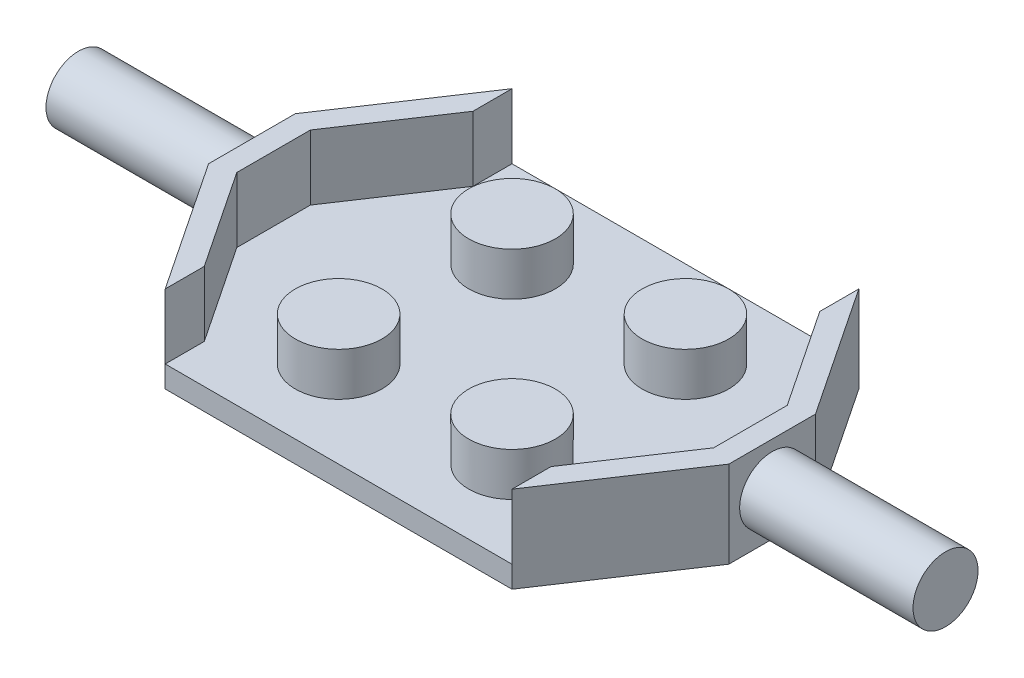
from build123d import *

# Parameters (mm, degrees)
BOSS_EXTRUDE1_DEPTH = 1
SKETCH2_R           = 2
BOSS_EXTRUDE2_DEPTH = 2
BOSS_EXTRUDE3_DEPTH = 3
SKETCH4_R           = 1.5
BOSS_EXTRUDE4_DEPTH = 8


with BuildPart() as part:
    # Sketch1 → Boss-Extrude1 (new body)
    with BuildSketch(Plane(origin=(0, 0, 0), x_dir=(1, 0, 0), z_dir=(0, 1, 0))):
        Polygon((0, -8), (0, 0), (-12, 0), (-12, -2), (-8, -8), align=None)
        Polygon((-12, 0), (0, 0), (0, 8), (-8, 8), (-12, 2), align=None)
    boss_extrude1 = extrude(amount=BOSS_EXTRUDE1_DEPTH)

    # Sketch2 → Boss-Extrude2 (add)
    with BuildSketch(Plane(origin=(0, 1, 0), x_dir=(1, 0, 0), z_dir=(0, 1, 0))):
        with Locations(Location((-4, 4, 0), (0, 0, 270))):
            Circle(SKETCH2_R)
        with Locations(Location((-4, -4, 0), (0, 0, 90))):
            Circle(SKETCH2_R)
    boss_extrude2 = extrude(amount=BOSS_EXTRUDE2_DEPTH)

    # Sketch3 → Boss-Extrude3 (add)
    with BuildSketch(Plane(origin=(0, 1, 0), x_dir=(1, 0, 0), z_dir=(0, 1, 0))):
        Polygon((-12, -2), (-8, -8), (-8, -6.197224362), (-11, -1.697224362), (-11, 1.697224362), (-8, 6.197224362), (-8, 8), (-12, 2), align=None)
    boss_extrude3 = extrude(amount=BOSS_EXTRUDE3_DEPTH)

    # Sketch4 → Boss-Extrude4 (add)
    with BuildSketch(Plane.ZY.offset(12)):
        with Locations((0, 2)):
            Circle(SKETCH4_R)
    boss_extrude4 = extrude(amount=BOSS_EXTRUDE4_DEPTH)

    # Mirror1: Boss-Extrude1, Boss-Extrude2, Boss-Extrude3, Boss-Extrude4 across plane
    add(boss_extrude1.mirror(Plane(origin=(0, 0, 0), x_dir=(0, 0, 1), z_dir=(1, 0, 0))))
    add(boss_extrude2.mirror(Plane(origin=(0, 0, 0), x_dir=(0, 0, 1), z_dir=(1, 0, 0))))
    add(boss_extrude3.mirror(Plane(origin=(0, 0, 0), x_dir=(0, 0, 1), z_dir=(1, 0, 0))))
    add(boss_extrude4.mirror(Plane(origin=(0, 0, 0), x_dir=(0, 0, 1), z_dir=(1, 0, 0))))


solid = part.part
